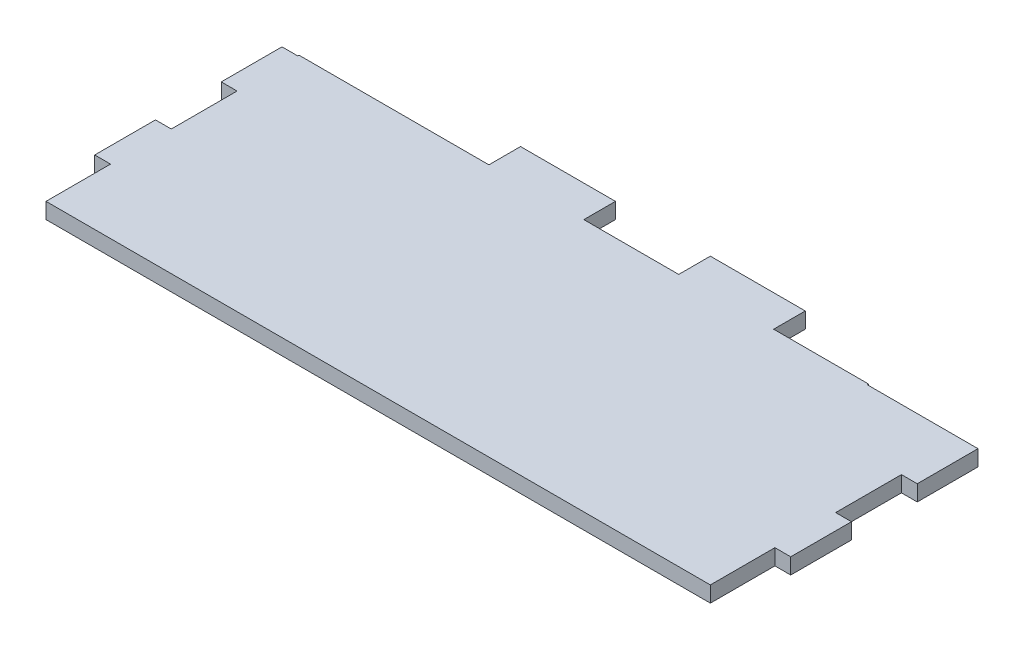
from build123d import *

# Parameters (mm, degrees)
SKETCH1_W           = 133.35
SKETCH1_H           = 101.6
BOSS_EXTRUDE1_DEPTH = 3.175
SKETCH2_W           = 3.175
SKETCH2_H           = 12.192
SKETCH2_W_2         = 19.05
SKETCH2_H_2         = 6.35
BOSS_EXTRUDE2_DEPTH = 3.175
SKETCH3_W           = 19.05
SKETCH3_H           = 6.35
SKETCH3_H_2         = 6.604
CUT_EXTRUDE1_DEPTH  = 91.306287849
SKETCH4_W           = 202.264069455
SKETCH4_H           = 60.449375303
CUT_EXTRUDE2_DEPTH  = 91.306287849


with BuildPart() as part:
    # Sketch1 → Boss-Extrude1 (new body)
    with BuildSketch(Plane(origin=(0, 0, 0), x_dir=(1, 0, 0), z_dir=(0, 1, 0))):
        Rectangle(SKETCH1_W, SKETCH1_H)
    extrude(amount=BOSS_EXTRUDE1_DEPTH)

    # Sketch2 → Boss-Extrude2 (add)
    with BuildSketch(Plane(origin=(0, 0, 0), x_dir=(-1, 0, 0), z_dir=(0, -1, 0))):
        with Locations((68.2625, -31.75)):
            Rectangle(SKETCH2_W, SKETCH2_H)
        with Locations((68.2625, -6.35)):
            Rectangle(SKETCH2_W, SKETCH2_H)
        with Locations((68.2625, 19.05)):
            Rectangle(SKETCH2_W, SKETCH2_H)
        with Locations((68.2625, 44.45)):
            Rectangle(SKETCH2_W, SKETCH2_H)
        with Locations((-68.2625, 44.45)):
            Rectangle(SKETCH2_W, SKETCH2_H)
        with Locations((-68.2625, 19.05)):
            Rectangle(SKETCH2_W, SKETCH2_H)
        with Locations((-68.2625, -6.35)):
            Rectangle(SKETCH2_W, SKETCH2_H)
        with Locations((-68.2625, -31.75)):
            Rectangle(SKETCH2_W, SKETCH2_H)
        with Locations((19.05, 53.975)):
            Rectangle(SKETCH2_W_2, SKETCH2_H_2)
        with Locations((57.15, 53.975)):
            Rectangle(SKETCH2_W_2, SKETCH2_H_2)
        with Locations((-19.05, 53.975)):
            Rectangle(SKETCH2_W_2, SKETCH2_H_2)
        with Locations((-57.15, 53.975)):
            Rectangle(SKETCH2_W_2, SKETCH2_H_2)
    extrude(amount=-BOSS_EXTRUDE2_DEPTH)

    # Sketch3 → Cut-Extrude1 (cut, through all)
    with BuildSketch(Plane(origin=(0, 0, 0), x_dir=(1, 0, 0), z_dir=(0, 1, 0))):
        with Locations((-57.15, 53.975)):
            Rectangle(SKETCH3_W, SKETCH3_H)
        with Locations((57.15, 53.848)):
            Rectangle(SKETCH3_W, SKETCH3_H_2)
    extrude(amount=CUT_EXTRUDE1_DEPTH, mode=Mode.SUBTRACT)

    # Sketch4 → Cut-Extrude2 (cut, through all)
    with BuildSketch(Plane(origin=(0, 0, 0), x_dir=(1, 0, 0), z_dir=(0, 1, 0))):
        with Locations((4.022296835, -30.224687652)):
            Rectangle(SKETCH4_W, SKETCH4_H)
    extrude(amount=CUT_EXTRUDE2_DEPTH, mode=Mode.SUBTRACT)


solid = part.part
